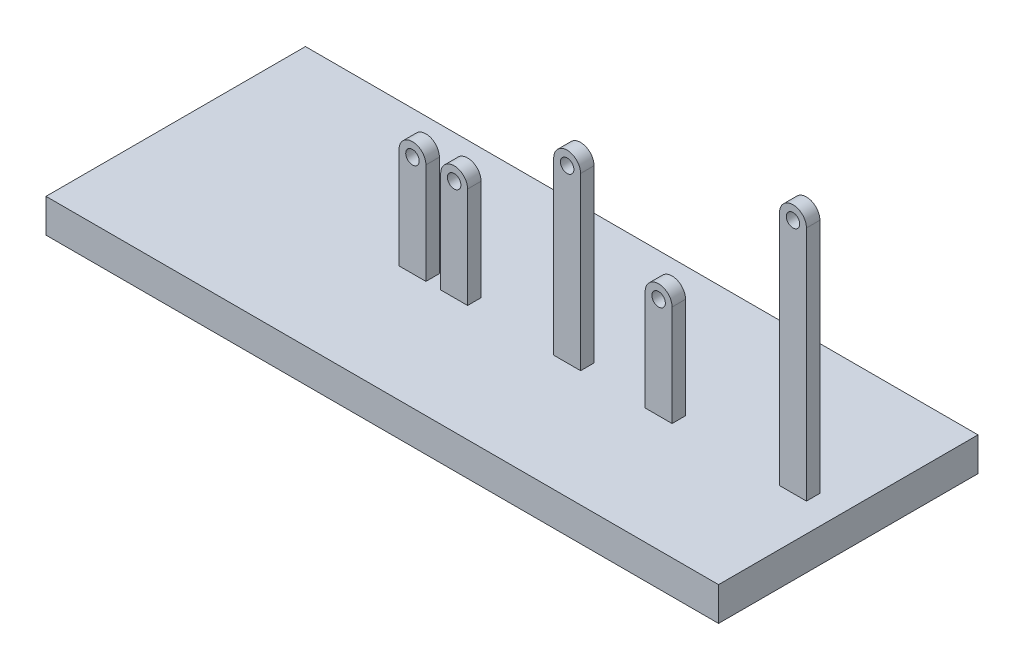
from build123d import *

# Parameters (mm, degrees)
SKETCH_1_W      = 100
SKETCH_1_H      = 38.575985264
EXTRUDE_1_DEPTH = 5
SKETCH_2_R      = 1
EXTRUDE_2_DEPTH = 2


with BuildPart() as part:
    # 草圖1 → 填料-伸長1 (new body)
    with BuildSketch(Plane(origin=(0, 0, 0), x_dir=(1, 0, 0), z_dir=(0, 1, 0))):
        Rectangle(SKETCH_1_W, SKETCH_1_H)
    extrude(amount=EXTRUDE_1_DEPTH)

    # 草圖2 → 填料-伸長2 (add)
    # profile 1 of 5: a face of its own
    with BuildSketch(Plane.XY):
        with BuildLine():
            Line((-8.6, 20), (-8.6, 0))
            Line((-8.6, 0), (-4.6, 0))
            Line((-4.6, 0), (-4.6, 20))
            ThreePointArc((-4.6, 20), (-6.6, 22), (-8.6, 20))
        make_face()
        with Locations((-6.6, 20)):
            Circle(SKETCH_2_R, mode=Mode.SUBTRACT)
    # profile 2 of 5: a face of its own
    with BuildSketch(Plane.XY):
        with BuildLine():
            Line((-14.8, 20), (-14.8, 0))
            Line((-14.8, 0), (-10.8, 0))
            Line((-10.8, 0), (-10.8, 20))
            ThreePointArc((-10.8, 20), (-12.8, 22), (-14.8, 20))
        make_face()
        with Locations((-12.8, 20)):
            Circle(SKETCH_2_R, mode=Mode.SUBTRACT)
    # profile 3 of 5: a face of its own
    with BuildSketch(Plane.XY):
        with BuildLine():
            Line((21.8, 20), (21.8, 0))
            Line((21.8, 0), (25.8, 0))
            Line((25.8, 0), (25.8, 20))
            ThreePointArc((25.8, 20), (23.8, 22), (21.8, 20))
        make_face()
        with Locations((23.8, 20)):
            Circle(SKETCH_2_R, mode=Mode.SUBTRACT)
    # profile 4 of 5: a face of its own
    with BuildSketch(Plane.XY):
        with BuildLine():
            Line((8.2, 30.4), (8.2, 0))
            Line((8.2, 0), (12.2, 0))
            Line((12.2, 0), (12.2, 30.4))
            ThreePointArc((12.2, 30.4), (10.2, 32.4), (8.2, 30.4))
        make_face()
        with Locations((10.2, 30.4)):
            Circle(SKETCH_2_R, mode=Mode.SUBTRACT)
    # profile 5 of 5: a face of its own
    with BuildSketch(Plane.XY):
        with BuildLine():
            Line((41.78, 40.17), (41.78, 0))
            Line((41.78, 0), (45.78, 0))
            Line((45.78, 0), (45.78, 40.17))
            ThreePointArc((45.78, 40.17), (43.78, 42.17), (41.78, 40.17))
        make_face()
        with Locations((43.78, 40.17)):
            Circle(SKETCH_2_R, mode=Mode.SUBTRACT)
    extrude(amount=EXTRUDE_2_DEPTH)


solid = part.part
